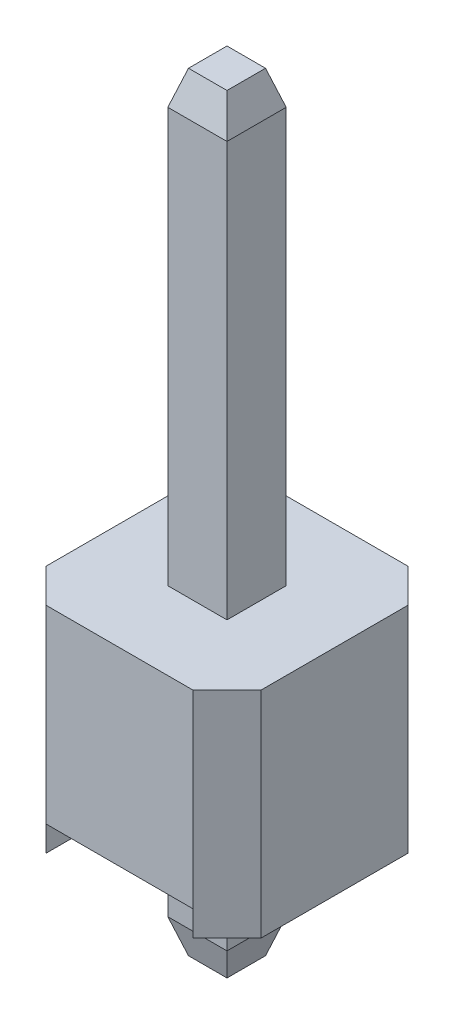
from build123d import *
from OCP.BRepFilletAPI import BRepFilletAPI_MakeChamfer

# Parameters (mm, degrees)
SKETCH1_W           = 2.54
SKETCH1_H           = 2.54
BOSS_EXTRUDE1_DEPTH = 2.54
CHAMFER1_SIZE       = 0.4
SKETCH2_W           = 1.74
SKETCH2_H           = 2.54
CUT_EXTRUDE1_DEPTH  = 0.3
SKETCH3_W           = 0.7
SKETCH3_H           = 0.7
BOSS_EXTRUDE2_DEPTH = 5.3
SKETCH4_W           = 0.7
SKETCH4_H           = 0.7
BOSS_EXTRUDE3_DEPTH = 1.55
CHAMFER2_SIZE       = 0.4
CHAMFER2_SIZE2      = 0.122292273


with BuildPart() as part:
    # Sketch1 → Boss-Extrude1 (new body)
    with BuildSketch(Plane(origin=(0, 0, 0), x_dir=(1, 0, 0), z_dir=(0, 1, 0))):
        Rectangle(SKETCH1_W, SKETCH1_H)
    extrude(amount=BOSS_EXTRUDE1_DEPTH)

    # Chamfer1
    chamfer1_edges = [part.edges().sort_by_distance(p)[0] for p in [
        (1.27, 1.27, 1.27),
        (-1.27, 1.27, 1.27),
        (-1.27, 1.27, -1.27),
        (1.27, 1.27, -1.27),
    ]]
    chamfer(chamfer1_edges, length=CHAMFER1_SIZE)

    # Sketch2 → Cut-Extrude1 (cut)
    with BuildSketch(Plane.XZ):
        Rectangle(SKETCH2_W, SKETCH2_H)
    extrude(amount=-CUT_EXTRUDE1_DEPTH, mode=Mode.SUBTRACT)

    # Sketch3 → Boss-Extrude2 (add)
    with BuildSketch(Plane(origin=(0, 2.54, 0), x_dir=(1, 0, 0), z_dir=(0, 1, 0))):
        Rectangle(SKETCH3_W, SKETCH3_H)
    extrude(amount=BOSS_EXTRUDE2_DEPTH)

    # Sketch4 → Boss-Extrude3 (add)
    with BuildSketch(Plane.XZ.offset(-0.3)):
        Rectangle(SKETCH4_W, SKETCH4_H)
    extrude(amount=BOSS_EXTRUDE3_DEPTH)

    # Chamfer2: one chamfer whose edges measure the first distance from different faces: ONE call of the kernel's chamfer builder (chamfer() names one face for all edges)
    chamfer2_edges_1 = [part.edges().sort_by_distance(p)[0] for p in [
        (-0.35, 7.84, 0),
    ]]
    chamfer2_side_1 = [part.faces().sort_by_distance(p)[0] for p in [
        (-0.35, 5.19, 0),
    ]]
    chamfer2_edges_2 = [part.edges().sort_by_distance(p)[0] for p in [
        (0, 7.84, 0.35),
    ]]
    chamfer2_side_2 = [part.faces().sort_by_distance(p)[0] for p in [
        (0, 5.19, 0.35),
    ]]
    chamfer2_edges_3 = [part.edges().sort_by_distance(p)[0] for p in [
        (0.35, 7.84, 0),
    ]]
    chamfer2_side_3 = [part.faces().sort_by_distance(p)[0] for p in [
        (0.35, 5.19, 0),
    ]]
    chamfer2_edges_4 = [part.edges().sort_by_distance(p)[0] for p in [
        (0, 7.84, -0.35),
    ]]
    chamfer2_side_4 = [part.faces().sort_by_distance(p)[0] for p in [
        (0, 5.19, -0.35),
    ]]
    chamfer2_edges_5 = [part.edges().sort_by_distance(p)[0] for p in [
        (0.35, -1.25, 0),
    ]]
    chamfer2_side_5 = [part.faces().sort_by_distance(p)[0] for p in [
        (0.35, -0.475, 0),
    ]]
    chamfer2_edges_6 = [part.edges().sort_by_distance(p)[0] for p in [
        (0, -1.25, 0.35),
    ]]
    chamfer2_side_6 = [part.faces().sort_by_distance(p)[0] for p in [
        (0, -0.475, 0.35),
    ]]
    chamfer2_edges_7 = [part.edges().sort_by_distance(p)[0] for p in [
        (-0.35, -1.25, 0),
    ]]
    chamfer2_side_7 = [part.faces().sort_by_distance(p)[0] for p in [
        (-0.35, -0.475, 0),
    ]]
    chamfer2_edges_8 = [part.edges().sort_by_distance(p)[0] for p in [
        (0, -1.25, -0.35),
    ]]
    chamfer2_side_8 = [part.faces().sort_by_distance(p)[0] for p in [
        (0, -0.475, -0.35),
    ]]
    chamfer2 = BRepFilletAPI_MakeChamfer(part.part.solid().wrapped)
    for e in chamfer2_edges_1:
        chamfer2.Add(CHAMFER2_SIZE, CHAMFER2_SIZE2, e.wrapped, chamfer2_side_1[0].wrapped)  # the first distance lies on this face
    for e in chamfer2_edges_2:
        chamfer2.Add(CHAMFER2_SIZE, CHAMFER2_SIZE2, e.wrapped, chamfer2_side_2[0].wrapped)  # the first distance lies on this face
    for e in chamfer2_edges_3:
        chamfer2.Add(CHAMFER2_SIZE, CHAMFER2_SIZE2, e.wrapped, chamfer2_side_3[0].wrapped)  # the first distance lies on this face
    for e in chamfer2_edges_4:
        chamfer2.Add(CHAMFER2_SIZE, CHAMFER2_SIZE2, e.wrapped, chamfer2_side_4[0].wrapped)  # the first distance lies on this face
    for e in chamfer2_edges_5:
        chamfer2.Add(CHAMFER2_SIZE, CHAMFER2_SIZE2, e.wrapped, chamfer2_side_5[0].wrapped)  # the first distance lies on this face
    for e in chamfer2_edges_6:
        chamfer2.Add(CHAMFER2_SIZE, CHAMFER2_SIZE2, e.wrapped, chamfer2_side_6[0].wrapped)  # the first distance lies on this face
    for e in chamfer2_edges_7:
        chamfer2.Add(CHAMFER2_SIZE, CHAMFER2_SIZE2, e.wrapped, chamfer2_side_7[0].wrapped)  # the first distance lies on this face
    for e in chamfer2_edges_8:
        chamfer2.Add(CHAMFER2_SIZE, CHAMFER2_SIZE2, e.wrapped, chamfer2_side_8[0].wrapped)  # the first distance lies on this face
    add(Compound.cast(chamfer2.Shape()), mode=Mode.REPLACE)


solid = part.part
